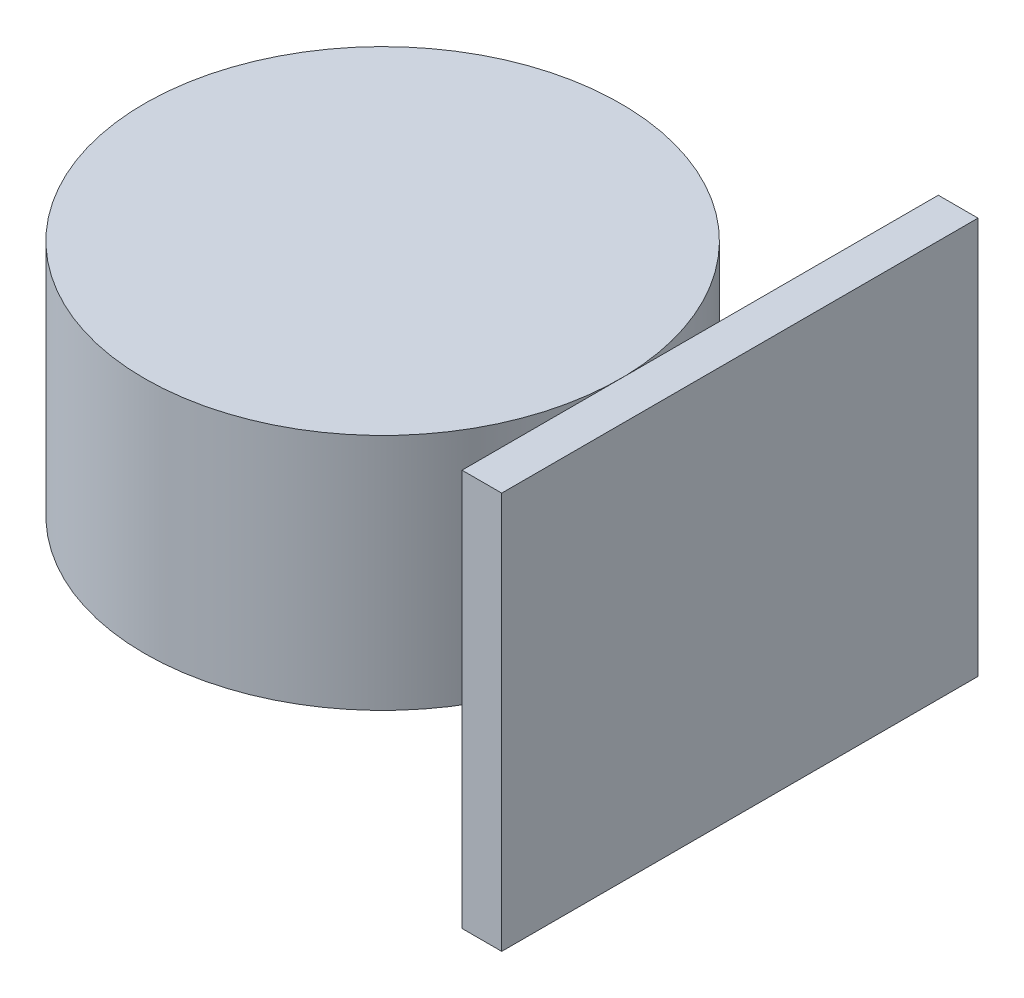
from build123d import *

# Parameters (mm, degrees)
SKETCH_1_R      = 30
EXTRUDE_1_DEPTH = 15
SKETCH_2_W      = 20
SKETCH_2_H      = 20
EXTRUDE_2_DEPTH = 40
SKETCH_3_W      = 60
SKETCH_3_H      = 50
EXTRUDE_3_DEPTH = 5


with BuildPart() as part:
    # 草图1 → 凸台-拉伸1 (new, symmetric)
    with BuildSketch(Plane(origin=(0, 0, 0), x_dir=(1, 0, 0), z_dir=(0, 1, 0))):
        with Locations(Location((0, 0, 0), (0, 0, 270))):
            Circle(SKETCH_1_R)
    extrude(amount=EXTRUDE_1_DEPTH, both=True)

    # 草图2 → 凸台-拉伸2 (add)
    with BuildSketch(Plane(origin=(0, 0, 0), x_dir=(0, 0, -1), z_dir=(1, 0, 0))):
        Rectangle(SKETCH_2_W, SKETCH_2_H)
    extrude(amount=EXTRUDE_2_DEPTH)

    # 草图3 → 凸台-拉伸3 (add)
    with BuildSketch(Plane(origin=(40, 0, 0), x_dir=(0, 0, -1), z_dir=(1, 0, 0))):
        Rectangle(SKETCH_3_W, SKETCH_3_H)
    extrude(amount=EXTRUDE_3_DEPTH)


solid = part.part
